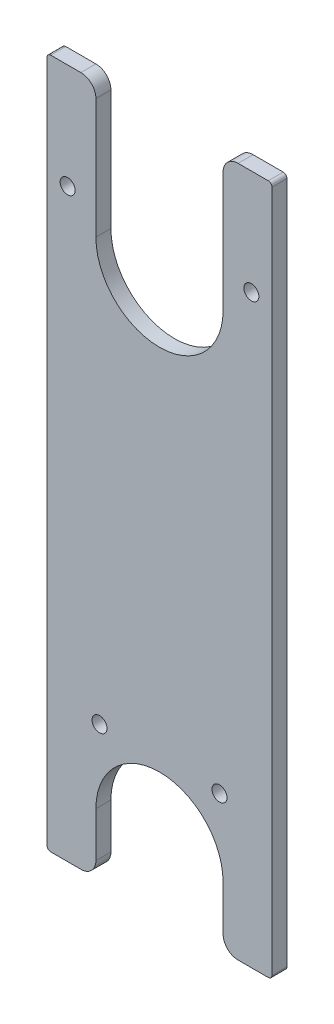
from build123d import *

# Parameters (mm, degrees)
BOSS_EXTRUDE1_DEPTH         = 6.35
FILLET1_R                   = 6.35
FILLET2_R                   = 1.5875
F_1_4_0_25_DIAMETER_HOLE1_D = 6.35


with BuildPart() as part:
    # Sketch2 → Boss-Extrude1 (new body)
    with BuildSketch(Plane.XY):
        with BuildLine():
            Line((-47.625, -279.4), (-26.924, -279.4))
            Line((-26.924, -279.4), (-26.924, -254))
            ThreePointArc((-26.924, -254), (0, -227.076), (26.924, -254))
            Line((26.924, -254), (26.924, -279.4))
            Line((26.924, -279.4), (47.625, -279.4))
            Line((47.625, -279.4), (47.625, 12.7))
            Line((47.625, 12.7), (26.924, 12.7))
            Line((26.924, 12.7), (26.924, -44.45))
            ThreePointArc((26.924, -44.45), (0, -71.374), (-26.924, -44.45))
            Line((-26.924, -44.45), (-26.924, 12.7))
            Line((-26.924, 12.7), (-47.625, 12.7))
            Line((-47.625, 12.7), (-47.625, -279.4))
        make_face()
    extrude(amount=BOSS_EXTRUDE1_DEPTH)

    # Fillet1
    fillet1_edges = [part.edges().sort_by_distance(p)[0] for p in [
        (-26.924, 12.7, 3.175),
        (26.924, 12.7, 3.175),
        (26.924, -279.4, 3.175),
        (-26.924, -279.4, 3.175),
    ]]
    fillet(fillet1_edges, radius=FILLET1_R)

    # Fillet2
    fillet2_edges = [part.edges().sort_by_distance(p)[0] for p in [
        (-47.625, 12.7, 3.175),
        (47.625, 12.7, 3.175),
        (47.625, -279.4, 3.175),
        (-47.625, -279.4, 3.175),
    ]]
    fillet(fillet2_edges, radius=FILLET2_R)

    # 1/4 (0.25) Diameter Hole1 (through all)
    with Locations(Plane.XY.offset(6.35)):
        with Locations((-25.4, -222.25), (-38.89375, -31.75), (38.89375, -31.75), (25.4, -222.25)):
            Hole(F_1_4_0_25_DIAMETER_HOLE1_D / 2)


solid = part.part
